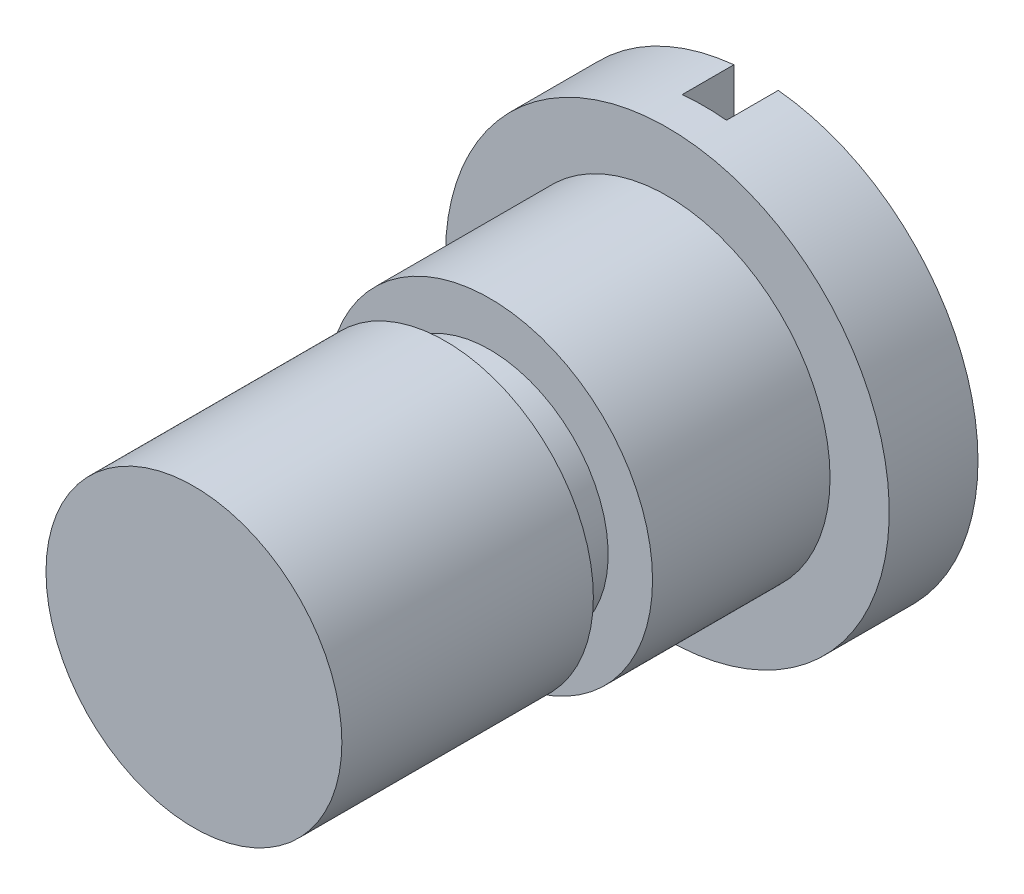
from build123d import *

# Parameters (mm, degrees)
CUT_EXTRUDE1_DEPTH = 3.5


with BuildPart() as part:
    # Sketch1 → Revolve1 (revolve)
    with BuildSketch(Plane(origin=(0, 0, 0), x_dir=(0, 0, -1), z_dir=(1, 0, 0)), mode=Mode.PRIVATE) as revolve1_sk:
        Polygon((0, 0), (0, 10), (17, 10), (17, 8), (20, 8), (20, 11), (32, 11), (32, 15), (38, 15), (38, 0), align=None)
    revolve(revolve1_sk.sketch.rotate(Axis((0, 0, -38), (0, 0, 1)), 90), axis=Axis((0, 0, -38), (0, 0, 1)))

    # Sketch2 → Cut-Extrude1 (cut)
    with BuildSketch(Plane(origin=(0, 0, -38), x_dir=(-1, 0, 0), z_dir=(0, 0, -1))):
        with BuildLine():
            Line((-1.5, 14.924811557), (-1.5, -14.924811557))
            ThreePointArc((-1.5, -14.924811557), (0, -15), (1.5, -14.924811557))
            Line((1.5, -14.924811557), (1.5, 14.924811557))
            ThreePointArc((1.5, 14.924811557), (0, 15), (-1.5, 14.924811557))
        make_face()
    extrude(amount=-CUT_EXTRUDE1_DEPTH, mode=Mode.SUBTRACT)


solid = part.part
